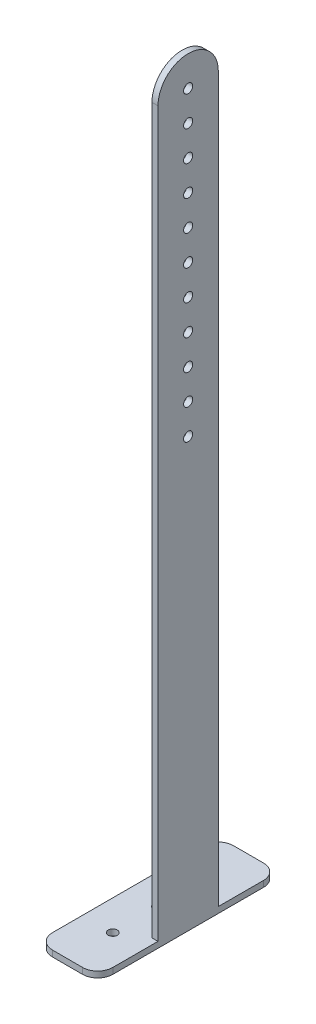
from build123d import *

# Parameters (mm, degrees)
SKETCH_1_W           = 2
SKETCH_1_H           = 250
EXTRUDE_1_DEPTH      = 20
EXTRUDE_2_DEPTH      = 20
EXTRUDE_2_DEPTH_BACK = 40
SKETCH_2_W           = 20
SKETCH_2_H           = 2
SKETCH_3_R           = 1.51
CUT_EXTRUDE_1_DEPTH  = 254.818833029
FILLET_1_R           = 5
FILLET_2_RADIUS      = 10
FILLET_2_LENGTH      = 2
SKETCH_4_R           = 1.51
CUT_EXTRUDE_2_DEPTH  = 254.818833029


with BuildPart() as part:
    # 草图1 → 凸台-拉伸1 (new body)
    with BuildSketch(Plane.XY):
        with Locations((1, 125)):
            Rectangle(SKETCH_1_W, SKETCH_1_H)
    extrude(amount=EXTRUDE_1_DEPTH)

    # 草图2 → 凸台-拉伸2 (add, two sides: drawn at the far end of the back side and taken through both)
    with BuildSketch(Plane(origin=(0, 0, 0), x_dir=(-1, 0, 0), z_dir=(0, 0, -1)).offset(-EXTRUDE_2_DEPTH_BACK)):
        with Locations((8, -1)):
            Rectangle(SKETCH_2_W, SKETCH_2_H)
    extrude(amount=EXTRUDE_2_DEPTH + EXTRUDE_2_DEPTH_BACK)

    # 草图3 → 切除-拉伸1 (cut, through all)
    with BuildSketch(Plane(origin=(0, 0, 0), x_dir=(1, 0, 0), z_dir=(0, 1, 0))):
        with Locations(Location((-8, -25, 0), (0, 0, 270))):
            Circle(SKETCH_3_R)
        with Locations(Location((-8, -10, 0), (0, 0, 270))):
            Circle(SKETCH_3_R)
        with Locations(Location((-8, 5, 0), (0, 0, 90))):
            Circle(SKETCH_3_R)
    extrude(amount=-CUT_EXTRUDE_1_DEPTH, mode=Mode.SUBTRACT)

    # 圆角1
    fillet_1_edges = [part.edges().sort_by_distance(p)[0] for p in [
        (-18, -1, 40),
        (2, -1, 40),
        (2, -1, -20),
        (-18, -1, -20),
    ]]
    fillet(fillet_1_edges, radius=FILLET_1_R)

    # 圆角2: full round fillet: the end face becomes a half cylinder, R = half its width
    fillet_2_face = Plane((1, 250, 10), x_dir=(1, 0, 0), z_dir=(0, 1, 0))  # on the end face: x along it, z out of the body
    fillet_2_slab = fillet_2_face.offset(-FILLET_2_RADIUS / 2) * Box(FILLET_2_LENGTH, 2 * FILLET_2_RADIUS, FILLET_2_RADIUS, mode=Mode.PRIVATE)  # the body's end, R deep
    fillet_2_round = Plane((1, 240, 10), x_dir=(0, 1, 0), z_dir=(1, 0, 0)) * Cylinder(FILLET_2_RADIUS, FILLET_2_LENGTH, mode=Mode.PRIVATE)  # its axis R under the face
    add(fillet_2_slab - fillet_2_round, mode=Mode.SUBTRACT)

    # 草图4 → 切除-拉伸2 (cut, through all)
    with BuildSketch(Plane.ZY):
        with Locations((10, 240)):
            Circle(SKETCH_4_R)
        with Locations((10, 230)):
            Circle(SKETCH_4_R)
        with Locations((10, 220)):
            Circle(SKETCH_4_R)
        with Locations((10, 210)):
            Circle(SKETCH_4_R)
        with Locations((10, 200)):
            Circle(SKETCH_4_R)
        with Locations((10, 190)):
            Circle(SKETCH_4_R)
        with Locations((10, 180)):
            Circle(SKETCH_4_R)
        with Locations((10, 170)):
            Circle(SKETCH_4_R)
        with Locations((10, 160)):
            Circle(SKETCH_4_R)
        with Locations((10, 150)):
            Circle(SKETCH_4_R)
        with Locations((10, 140)):
            Circle(SKETCH_4_R)
    extrude(amount=-CUT_EXTRUDE_2_DEPTH, mode=Mode.SUBTRACT)


solid = part.part
